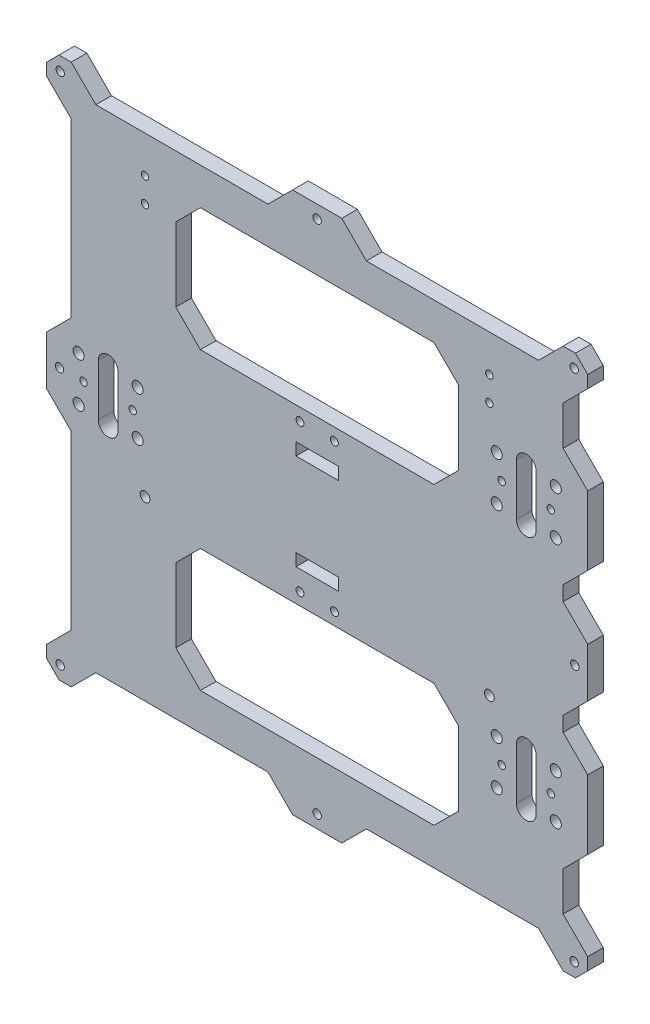
from build123d import *

# Parameters (mm, degrees)
BOSS_EXTRUDE1_DEPTH = 6.35
CUT_EXTRUDE1_DEPTH  = 6.35
CUT_EXTRUDE2_DEPTH  = 6.35
MODEL_7_R           = 1.7
MODEL_7_R_2         = 1.5
MODEL_7_R_3         = 2.25
MODEL_7_R_4         = 1.6
MODEL_7_R_5         = 2
CUT_EXTRUDE3_DEPTH  = 6.35
MODEL_8_W           = 17.2
MODEL_8_H           = 5
CUT_EXTRUDE4_DEPTH  = 6.35


with BuildPart() as part:
    # Model → Boss-Extrude1 (new body)
    with BuildSketch(Plane.XY):
        Polygon((110, -105), (110, -100), (100, -90), (100, -74), (110, -64), (110, -36), (100, -26), (100, -20), (110, -10), (110, 10), (100, 20), (100, 26), (110, 36), (110, 64), (100, 74), (100, 90), (110, 100), (110, 105), (105, 110), (100, 110), (90, 100), (20, 100), (10, 110), (-10, 110), (-20, 100), (-90, 100), (-100, 110), (-105, 110), (-110, 105), (-110, 100), (-100, 90), (-100, 20), (-110, 10), (-110, -10), (-100, -20), (-100, -90), (-110, -100), (-110, -105), (-105, -110), (-100, -110), (-90, -100), (-20, -100), (-10, -110), (10, -110), (20, -100), (90, -100), (100, -110), (105, -110), align=None)
    extrude(amount=BOSS_EXTRUDE1_DEPTH)

    # Model<4> → Cut-Extrude1 (cut)
    with BuildSketch(Plane.XY):
        Polygon((-47.489728574, 85), (-57.489728574, 75), (-57.489728574, 45), (-47.489728574, 35), (47.489728574, 35), (57.489728574, 45), (57.489728574, 75), (47.489728574, 85), align=None)
    extrude(amount=CUT_EXTRUDE1_DEPTH, mode=Mode.SUBTRACT)

    # Model<5> → Cut-Extrude2 (cut)
    with BuildSketch(Plane.XY):
        Polygon((57.489728574, -45), (47.489728574, -35), (-47.489728574, -35), (-57.489728574, -45), (-57.489728574, -75), (-47.489728574, -85), (47.489728574, -85), (57.489728574, -75), align=None)
    extrude(amount=CUT_EXTRUDE2_DEPTH, mode=Mode.SUBTRACT)

    # Model<7> → Cut-Extrude3 (cut)
    with BuildSketch(Plane.XY):
        with Locations((0, -104.75)):
            Circle(MODEL_7_R)
        with Locations((104.75, 0)):
            Circle(MODEL_7_R)
        with Locations((104.5, 104.5)):
            Circle(MODEL_7_R)
        with Locations((104.5, -104.5)):
            Circle(MODEL_7_R)
        with Locations((-95, 0)):
            Circle(MODEL_7_R_2)
        with Locations((-75, 0)):
            Circle(MODEL_7_R_2)
        with Locations((-73, 9)):
            Circle(MODEL_7_R_3)
        with Locations((-73, -9)):
            Circle(MODEL_7_R_3)
        with Locations((-97, -9)):
            Circle(MODEL_7_R_3)
        with Locations((-97, 9)):
            Circle(MODEL_7_R_3)
        with Locations((75, 50)):
            Circle(MODEL_7_R_2)
        with Locations((95, 50)):
            Circle(MODEL_7_R_2)
        with Locations((75, -50)):
            Circle(MODEL_7_R_2)
        with Locations((95, -50)):
            Circle(MODEL_7_R_2)
        with Locations((97, 59)):
            Circle(MODEL_7_R_3)
        with Locations((97, 41)):
            Circle(MODEL_7_R_3)
        with Locations((73, 41)):
            Circle(MODEL_7_R_3)
        with Locations((73, 59)):
            Circle(MODEL_7_R_3)
        with Locations((97, -41)):
            Circle(MODEL_7_R_3)
        with Locations((97, -59)):
            Circle(MODEL_7_R_3)
        with Locations((73, -59)):
            Circle(MODEL_7_R_3)
        with Locations((73, -41)):
            Circle(MODEL_7_R_3)
        with Locations((-104.75, 0)):
            Circle(MODEL_7_R)
        with Locations((0, 104.75)):
            Circle(MODEL_7_R)
        with Locations((-104.5, 104.5)):
            Circle(MODEL_7_R)
        with Locations((-104.5, -104.5)):
            Circle(MODEL_7_R)
        with Locations((-7, 30)):
            Circle(MODEL_7_R_4)
        with Locations((7, 30)):
            Circle(MODEL_7_R_4)
        with Locations((-7, -30)):
            Circle(MODEL_7_R_4)
        with Locations((7, -30)):
            Circle(MODEL_7_R_4)
        with Locations((70, -28)):
            Circle(MODEL_7_R_5)
        with Locations((-70, -28)):
            Circle(MODEL_7_R_5)
        with Locations((-70, 85)):
            Circle(MODEL_7_R_2)
        with Locations((-70, 75)):
            Circle(MODEL_7_R_2)
        with Locations((70, 85)):
            Circle(MODEL_7_R_2)
        with Locations((70, 75)):
            Circle(MODEL_7_R_2)
    extrude(amount=CUT_EXTRUDE3_DEPTH, mode=Mode.SUBTRACT)

    # Model<8> → Cut-Extrude4 (cut)
    with BuildSketch(Plane.XY):
        with BuildLine():
            Line((-81, -10.5), (-81, 10.5))
            ThreePointArc((-81, 10.5), (-85, 14.5), (-89, 10.5))
            Line((-89, 10.5), (-89, -10.5))
            ThreePointArc((-89, -10.5), (-85, -14.5), (-81, -10.5))
        make_face()
        with BuildLine():
            Line((89, 39.5), (89, 60.5))
            ThreePointArc((89, 60.5), (85, 64.5), (81, 60.5))
            Line((81, 60.5), (81, 39.5))
            ThreePointArc((81, 39.5), (85, 35.5), (89, 39.5))
        make_face()
        with BuildLine():
            Line((89, -60.5), (89, -39.5))
            ThreePointArc((89, -39.5), (85, -35.5), (81, -39.5))
            Line((81, -39.5), (81, -60.5))
            ThreePointArc((81, -60.5), (85, -64.5), (89, -60.5))
        make_face()
        with Locations((0, 19.5)):
            Rectangle(MODEL_8_W, MODEL_8_H)
        with Locations((0, -19.5)):
            Rectangle(MODEL_8_W, MODEL_8_H)
    extrude(amount=CUT_EXTRUDE4_DEPTH, mode=Mode.SUBTRACT)


solid = part.part
